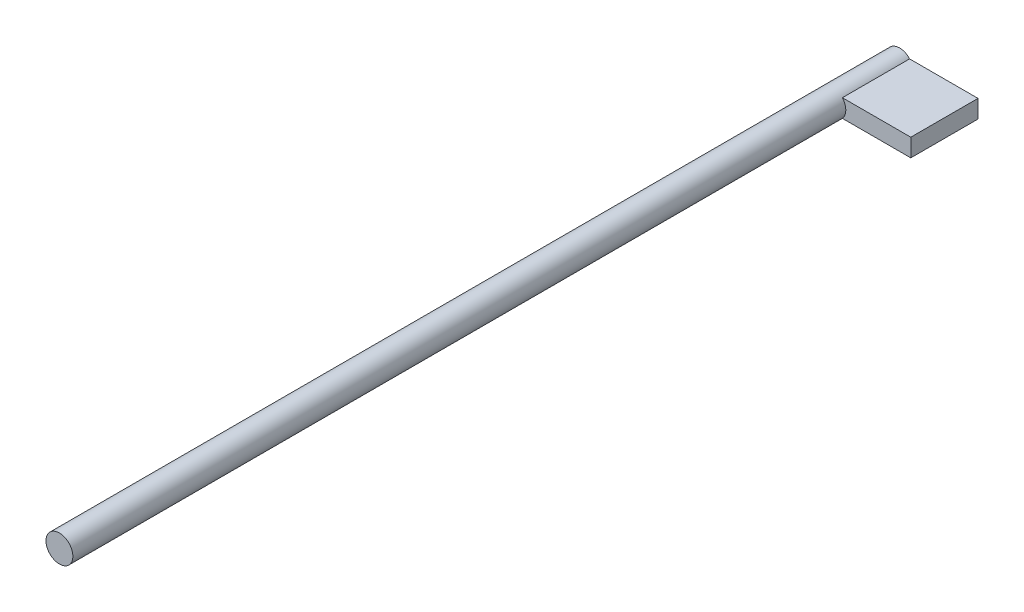
from build123d import *

# Parameters (mm, degrees)
SKETCH1_R           = 6
BOSS_EXTRUDE1_DEPTH = 375
SKETCH2_W           = 30
SKETCH2_H           = 8
BOSS_EXTRUDE2_DEPTH = 35


with BuildPart() as part:
    # Sketch1 → Boss-Extrude1 (new body)
    with BuildSketch(Plane.XY):
        Circle(SKETCH1_R)
    extrude(amount=-BOSS_EXTRUDE1_DEPTH)

    # Sketch2 → Boss-Extrude2 (add)
    with BuildSketch(Plane(origin=(0, 0, 0), x_dir=(0, 0, -1), z_dir=(1, 0, 0))):
        with Locations((360, 0)):
            Rectangle(SKETCH2_W, SKETCH2_H)
    extrude(amount=BOSS_EXTRUDE2_DEPTH)


solid = part.part
